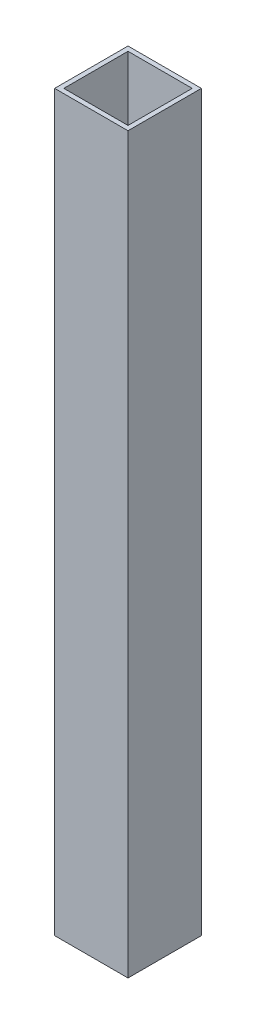
from build123d import *

# Parameters (mm, degrees)
SKETCH1_W           = 25.4
SKETCH1_H           = 25.4
SKETCH1_W_2         = 22.225
SKETCH1_H_2         = 22.225
BOSS_EXTRUDE1_DEPTH = 254


with BuildPart() as part:
    # Sketch1 → Boss-Extrude1 (new body)
    with BuildSketch(Plane(origin=(0, 0, 0), x_dir=(1, 0, 0), z_dir=(0, 1, 0))):
        Rectangle(SKETCH1_W, SKETCH1_H)
        Rectangle(SKETCH1_W_2, SKETCH1_H_2, mode=Mode.SUBTRACT)
    extrude(amount=BOSS_EXTRUDE1_DEPTH)


solid = part.part
